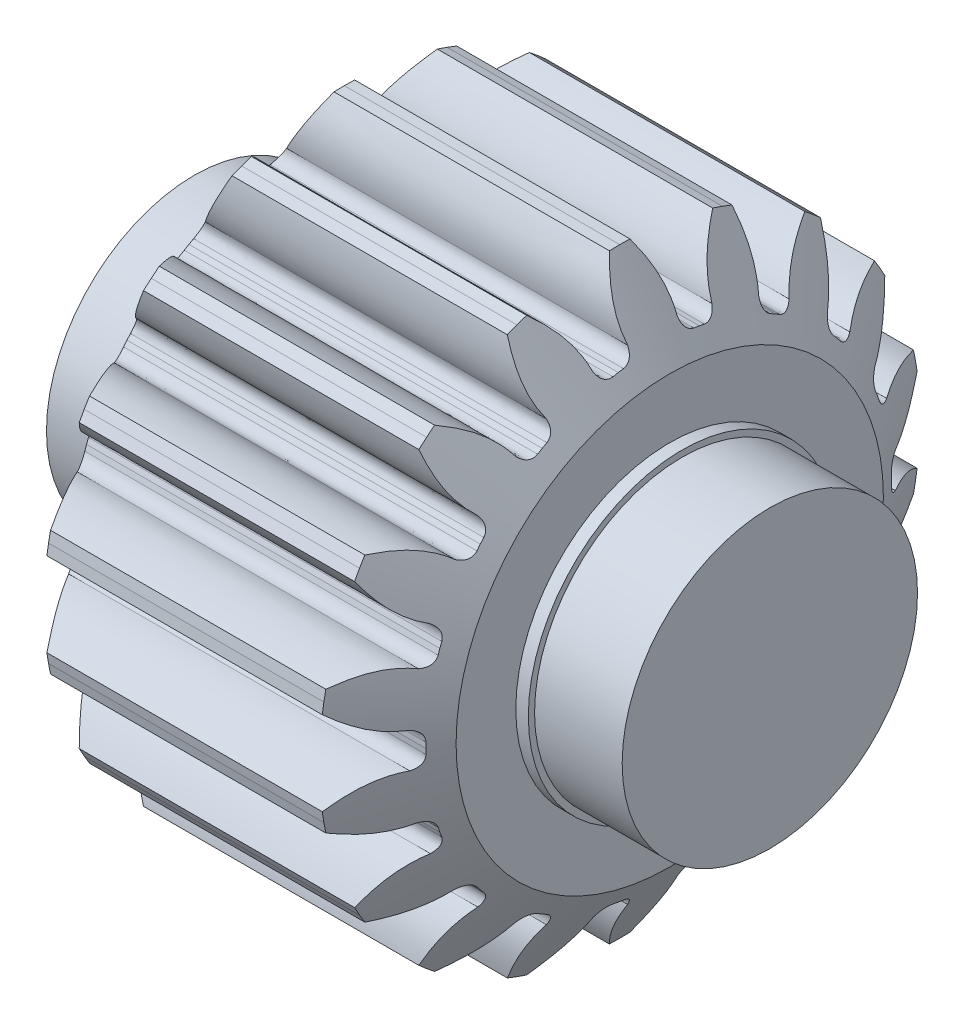
from build123d import *

# Parameters (mm, degrees)
SKETCH4_R          = 13.977653577
CUT_EXTRUDE1_DEPTH = 55.965978094


with BuildPart() as part:
    # Sketch3 → Revolve1 (revolve)
    with BuildSketch(Plane.XY, mode=Mode.PRIVATE) as revolve1_sk:
        Polygon((98.499999011, 42.358835602), (98.499999011, 36.458835602), (121.499999011, 36.458835602), (121.499999011, 42.358835602), (117.999999011, 42.358835602), (117.999999011, 42.608835602), (117.499999011, 42.608835602), (117.499999011, 44.994733987), (115.499999011, 48.458835602), (104.499999011, 48.458835602), (102.499999011, 44.994733987), (102.499999011, 42.608835602), (101.999999011, 42.608835602), (101.999999011, 42.358835602), align=None)
    revolve(revolve1_sk.sketch.rotate(Axis((78.437875692, 36.458835602, 0), (1, 0, 0)), 90), axis=Axis((78.437875692, 36.458835602, 0), (1, 0, 0)))

    # Sketch4 → Cut-Extrude1 (cut, through all)
    with BuildSketch(Plane(origin=(121.499999011, 0, 0), x_dir=(0, 0, -1), z_dir=(1, 0, 0))):
        with Locations((0, 36.458835602)):
            Circle(SKETCH4_R)
        with BuildLine():
            Line((0, 48.458835602), (0.411903779, 48.451764155))
            add(Edge.make_bspline(
                [(0.411903779, 48.451764155), (0.834063086, 47.721667245), (1.119349528, 46.985052709), (0.994321411, 46.133072814)],
                knots=[0, 0, 0, 0, 1, 1, 1, 1], degree=3))
            add(Edge.make_bspline(
                [(0.994321411, 46.133072814), (1.028481403, 45.730941927), (1.404187744, 45.652187347)],
                knots=[0, 0, 0, 1, 1, 1], degree=2))
            Line((1.404187744, 45.652187347), (1.615574453, 45.621213624))
            Line((1.615574453, 45.621213624), (1.82480662, 45.578020891))
            add(Edge.make_bspline(
                [(2.374427505, 45.889722874), (2.204790749, 45.523526851), (1.82480662, 45.578020891)],
                knots=[0, 0, 0, 1, 1, 1], degree=2))
            add(Edge.make_bspline(
                [(3.714760201, 47.869381454), (3.068352366, 47.327701762), (2.548333792, 46.733084228), (2.374427505, 45.889722874)],
                knots=[0, 0, 0, 0, 1, 1, 1, 1], degree=3))
            Line((3.714760201, 47.869381454), (4.10424172, 47.735147051))
            Line((4.10424172, 47.735147051), (4.488886084, 47.587622675))
            add(Edge.make_bspline(
                [(4.488886084, 47.587622675), (4.63587822, 46.75716901), (4.652022775, 45.967404056), (4.243140491, 45.209566971)],
                knots=[0, 0, 0, 0, 1, 1, 1, 1], degree=3))
            add(Edge.make_bspline(
                [(4.243140491, 45.209566971), (4.137703519, 44.820004138), (4.463816343, 44.617499904)],
                knots=[0, 0, 0, 1, 1, 1], degree=2))
            Line((4.463816343, 44.617499904), (4.651861236, 44.516095612))
            Line((4.651861236, 44.516095612), (4.833702375, 44.403946104))
            add(Edge.make_bspline(
                [(5.456785422, 44.508868743), (5.172132598, 44.222776231), (4.833702375, 44.403946104)],
                knots=[0, 0, 0, 1, 1, 1], degree=2))
            add(Edge.make_bspline(
                [(7.393369277, 45.910718522), (6.600679238, 45.622790613), (5.908650448, 45.241889731), (5.456785422, 44.508868743)],
                knots=[0, 0, 0, 0, 1, 1, 1, 1], degree=3))
            Line((7.393369277, 45.910718522), (7.713451316, 45.651368919))
            Line((7.713451316, 45.651368919), (8.024442478, 45.381185231))
            add(Edge.make_bspline(
                [(8.024442478, 45.381185231), (7.878538022, 44.550539779), (7.623593419, 43.802881716), (6.980174205, 43.230593777)],
                knots=[0, 0, 0, 0, 1, 1, 1, 1], degree=3))
            add(Edge.make_bspline(
                [(6.980174205, 43.230593777), (6.747857525, 42.900586026), (6.985042812, 42.598757137)],
                knots=[0, 0, 0, 1, 1, 1], degree=2))
            Line((6.985042812, 42.598757137), (7.1270649, 42.439153131))
            Line((7.1270649, 42.439153131), (7.259582286, 42.271573733))
            add(Edge.make_bspline(
                [(7.880974483, 42.15706181), (7.515638923, 41.985579787), (7.259582286, 42.271573733)],
                knots=[0, 0, 0, 1, 1, 1], degree=2))
            add(Edge.make_bspline(
                [(10.180228903, 42.812019014), (9.336866779, 42.812571244), (8.556296656, 42.691329282), (7.880974483, 42.15706181)],
                knots=[0, 0, 0, 0, 1, 1, 1, 1], degree=3))
            Line((10.180228903, 42.812019014), (10.392304845, 42.458835602))
            Line((10.392304845, 42.458835602), (10.592132682, 42.098580742))
            add(Edge.make_bspline(
                [(10.592132682, 42.098580742), (10.170929864, 41.367931603), (9.675646184, 40.752559029), (8.875295894, 40.434846606)],
                knots=[0, 0, 0, 0, 1, 1, 1, 1], degree=3))
            add(Edge.make_bspline(
                [(8.875295894, 40.434846606), (8.544120326, 40.204197742), (8.66377003, 39.839449217)],
                knots=[0, 0, 0, 1, 1, 1], degree=2))
            Line((8.66377003, 39.839449217), (8.742639352, 39.640896095))
            Line((8.742639352, 39.640896095), (8.809849432, 39.438099356))
            add(Edge.make_bspline(
                [(9.35460171, 39.117964699), (8.952648274, 39.081776428), (8.809849432, 39.438099356)],
                knots=[0, 0, 0, 1, 1, 1], degree=2))
            add(Edge.make_bspline(
                [(11.73920268, 38.947031825), (10.946890388, 39.235997585), (10.171927211, 39.389038113), (9.35460171, 39.117964699)],
                knots=[0, 0, 0, 0, 1, 1, 1, 1], degree=3))
            Line((11.73920268, 38.947031825), (11.817693036, 38.542613734))
            Line((11.817693036, 38.542613734), (11.882255361, 38.135739755))
            add(Edge.make_bspline(
                [(11.882255361, 38.135739755), (11.236557458, 37.593213999), (10.560673222, 37.184349927), (9.699925912, 37.159533829)],
                knots=[0, 0, 0, 0, 1, 1, 1, 1], degree=3))
            add(Edge.make_bspline(
                [(9.699925912, 37.159533829), (9.309836117, 37.056063509), (9.297518718, 36.672389402)],
                knots=[0, 0, 0, 1, 1, 1], degree=2))
            Line((9.297518718, 36.672389402), (9.303722472, 36.458835602))
            Line((9.303722472, 36.458835602), (9.297518718, 36.245281802))
            add(Edge.make_bspline(
                [(9.699925912, 35.758137374), (9.309836117, 35.861607695), (9.297518718, 36.245281802)],
                knots=[0, 0, 0, 1, 1, 1], degree=2))
            add(Edge.make_bspline(
                [(11.882255361, 34.781931448), (11.236557458, 35.324457205), (10.560673222, 35.733321277), (9.699925912, 35.758137374)],
                knots=[0, 0, 0, 0, 1, 1, 1, 1], degree=3))
            Line((11.882255361, 34.781931448), (11.817693036, 34.37505747))
            Line((11.817693036, 34.37505747), (11.73920268, 33.970639379))
            add(Edge.make_bspline(
                [(11.73920268, 33.970639379), (10.946890388, 33.681673618), (10.171927211, 33.52863309), (9.35460171, 33.799706505)],
                knots=[0, 0, 0, 0, 1, 1, 1, 1], degree=3))
            add(Edge.make_bspline(
                [(9.35460171, 33.799706505), (8.952648274, 33.835894776), (8.809849432, 33.479571847)],
                knots=[0, 0, 0, 1, 1, 1], degree=2))
            Line((8.809849432, 33.479571847), (8.742639352, 33.276775109))
            Line((8.742639352, 33.276775109), (8.66377003, 33.078221987))
            add(Edge.make_bspline(
                [(8.875295894, 32.482824597), (8.544120326, 32.713473461), (8.66377003, 33.078221987)],
                knots=[0, 0, 0, 1, 1, 1], degree=2))
            add(Edge.make_bspline(
                [(10.592132682, 30.819090461), (10.170929864, 31.549739601), (9.675646184, 32.165112175), (8.875295894, 32.482824597)],
                knots=[0, 0, 0, 0, 1, 1, 1, 1], degree=3))
            Line((10.592132682, 30.819090461), (10.392304845, 30.458835602))
            Line((10.392304845, 30.458835602), (10.180228903, 30.105652189))
            add(Edge.make_bspline(
                [(10.180228903, 30.105652189), (9.336866779, 30.10509996), (8.556296656, 30.226341922), (7.880974483, 30.760609394)],
                knots=[0, 0, 0, 0, 1, 1, 1, 1], degree=3))
            add(Edge.make_bspline(
                [(7.880974483, 30.760609394), (7.515638923, 30.932091417), (7.259582286, 30.646097471)],
                knots=[0, 0, 0, 1, 1, 1], degree=2))
            Line((7.259582286, 30.646097471), (7.1270649, 30.478518073))
            Line((7.1270649, 30.478518073), (6.985042812, 30.318914067))
            add(Edge.make_bspline(
                [(6.980174205, 29.687077427), (6.747857525, 30.017085178), (6.985042812, 30.318914067)],
                knots=[0, 0, 0, 1, 1, 1], degree=2))
            add(Edge.make_bspline(
                [(8.024442478, 27.536485972), (7.878538022, 28.367131425), (7.623593419, 29.114789487), (6.980174205, 29.687077427)],
                knots=[0, 0, 0, 0, 1, 1, 1, 1], degree=3))
            Line((8.024442478, 27.536485972), (7.713451316, 27.266302284))
            Line((7.713451316, 27.266302284), (7.393369277, 27.006952682))
            add(Edge.make_bspline(
                [(7.393369277, 27.006952682), (6.600679238, 27.294880591), (5.908650448, 27.675781473), (5.456785422, 28.408802461)],
                knots=[0, 0, 0, 0, 1, 1, 1, 1], degree=3))
            add(Edge.make_bspline(
                [(5.456785422, 28.408802461), (5.172132598, 28.694894973), (4.833702375, 28.5137251)],
                knots=[0, 0, 0, 1, 1, 1], degree=2))
            Line((4.833702375, 28.5137251), (4.651861236, 28.401575592))
            Line((4.651861236, 28.401575592), (4.463816343, 28.3001713))
            add(Edge.make_bspline(
                [(4.243140491, 27.708104233), (4.137703519, 28.097667066), (4.463816343, 28.3001713)],
                knots=[0, 0, 0, 1, 1, 1], degree=2))
            add(Edge.make_bspline(
                [(4.488886084, 25.330048528), (4.63587822, 26.160502194), (4.652022775, 26.950267148), (4.243140491, 27.708104233)],
                knots=[0, 0, 0, 0, 1, 1, 1, 1], degree=3))
            Line((4.488886084, 25.330048528), (4.10424172, 25.182524152))
            Line((4.10424172, 25.182524152), (3.714760201, 25.04828975))
            add(Edge.make_bspline(
                [(3.714760201, 25.04828975), (3.068352366, 25.589969441), (2.548333792, 26.184586976), (2.374427505, 27.02794833)],
                knots=[0, 0, 0, 0, 1, 1, 1, 1], degree=3))
            add(Edge.make_bspline(
                [(2.374427505, 27.02794833), (2.204790749, 27.394144352), (1.82480662, 27.339650313)],
                knots=[0, 0, 0, 1, 1, 1], degree=2))
            Line((1.82480662, 27.339650313), (1.615574453, 27.29645758))
            Line((1.615574453, 27.29645758), (1.404187744, 27.265483856))
            add(Edge.make_bspline(
                [(0.994321411, 26.784598389), (1.028481403, 27.186729277), (1.404187744, 27.265483856)],
                knots=[0, 0, 0, 1, 1, 1], degree=2))
            add(Edge.make_bspline(
                [(0.411903779, 24.465907049), (0.834063086, 25.196003959), (1.119349528, 25.932618495), (0.994321411, 26.784598389)],
                knots=[0, 0, 0, 0, 1, 1, 1, 1], degree=3))
            Line((0.411903779, 24.465907049), (0, 24.458835602))
            Line((0, 24.458835602), (-0.411903779, 24.465907049))
            add(Edge.make_bspline(
                [(-0.411903779, 24.465907049), (-0.834063086, 25.196003959), (-1.119349528, 25.932618495), (-0.994321411, 26.784598389)],
                knots=[0, 0, 0, 0, 1, 1, 1, 1], degree=3))
            add(Edge.make_bspline(
                [(-0.994321411, 26.784598389), (-1.028481403, 27.186729277), (-1.404187744, 27.265483856)],
                knots=[0, 0, 0, 1, 1, 1], degree=2))
            Line((-1.404187744, 27.265483856), (-1.615574453, 27.29645758))
            Line((-1.615574453, 27.29645758), (-1.82480662, 27.339650313))
            add(Edge.make_bspline(
                [(-2.374427505, 27.02794833), (-2.204790749, 27.394144352), (-1.82480662, 27.339650313)],
                knots=[0, 0, 0, 1, 1, 1], degree=2))
            add(Edge.make_bspline(
                [(-3.714760201, 25.04828975), (-3.068352366, 25.589969441), (-2.548333792, 26.184586976), (-2.374427505, 27.02794833)],
                knots=[0, 0, 0, 0, 1, 1, 1, 1], degree=3))
            Line((-3.714760201, 25.04828975), (-4.10424172, 25.182524152))
            Line((-4.10424172, 25.182524152), (-4.488886084, 25.330048528))
            add(Edge.make_bspline(
                [(-4.488886084, 25.330048528), (-4.63587822, 26.160502194), (-4.652022775, 26.950267148), (-4.243140491, 27.708104233)],
                knots=[0, 0, 0, 0, 1, 1, 1, 1], degree=3))
            add(Edge.make_bspline(
                [(-4.243140491, 27.708104233), (-4.137703519, 28.097667066), (-4.463816343, 28.3001713)],
                knots=[0, 0, 0, 1, 1, 1], degree=2))
            Line((-4.463816343, 28.3001713), (-4.651861236, 28.401575592))
            Line((-4.651861236, 28.401575592), (-4.833702375, 28.5137251))
            add(Edge.make_bspline(
                [(-5.456785422, 28.408802461), (-5.172132598, 28.694894973), (-4.833702375, 28.5137251)],
                knots=[0, 0, 0, 1, 1, 1], degree=2))
            add(Edge.make_bspline(
                [(-7.393369277, 27.006952682), (-6.600679238, 27.294880591), (-5.908650448, 27.675781473), (-5.456785422, 28.408802461)],
                knots=[0, 0, 0, 0, 1, 1, 1, 1], degree=3))
            Line((-7.393369277, 27.006952682), (-7.713451316, 27.266302284))
            Line((-7.713451316, 27.266302284), (-8.024442478, 27.536485972))
            add(Edge.make_bspline(
                [(-8.024442478, 27.536485972), (-7.878538022, 28.367131425), (-7.623593419, 29.114789487), (-6.980174205, 29.687077427)],
                knots=[0, 0, 0, 0, 1, 1, 1, 1], degree=3))
            add(Edge.make_bspline(
                [(-6.980174205, 29.687077427), (-6.747857525, 30.017085178), (-6.985042812, 30.318914067)],
                knots=[0, 0, 0, 1, 1, 1], degree=2))
            Line((-6.985042812, 30.318914067), (-7.1270649, 30.478518073))
            Line((-7.1270649, 30.478518073), (-7.259582286, 30.646097471))
            add(Edge.make_bspline(
                [(-7.880974483, 30.760609394), (-7.515638923, 30.932091417), (-7.259582286, 30.646097471)],
                knots=[0, 0, 0, 1, 1, 1], degree=2))
            add(Edge.make_bspline(
                [(-10.180228903, 30.105652189), (-9.336866779, 30.10509996), (-8.556296656, 30.226341922), (-7.880974483, 30.760609394)],
                knots=[0, 0, 0, 0, 1, 1, 1, 1], degree=3))
            Line((-10.180228903, 30.105652189), (-10.392304845, 30.458835602))
            Line((-10.392304845, 30.458835602), (-10.592132682, 30.819090461))
            add(Edge.make_bspline(
                [(-10.592132682, 30.819090461), (-10.170929864, 31.549739601), (-9.675646184, 32.165112175), (-8.875295894, 32.482824597)],
                knots=[0, 0, 0, 0, 1, 1, 1, 1], degree=3))
            add(Edge.make_bspline(
                [(-8.875295894, 32.482824597), (-8.544120326, 32.713473461), (-8.66377003, 33.078221987)],
                knots=[0, 0, 0, 1, 1, 1], degree=2))
            Line((-8.66377003, 33.078221987), (-8.742639352, 33.276775109))
            Line((-8.742639352, 33.276775109), (-8.809849432, 33.479571847))
            add(Edge.make_bspline(
                [(-9.35460171, 33.799706505), (-8.952648274, 33.835894776), (-8.809849432, 33.479571847)],
                knots=[0, 0, 0, 1, 1, 1], degree=2))
            add(Edge.make_bspline(
                [(-11.73920268, 33.970639379), (-10.946890388, 33.681673618), (-10.171927211, 33.52863309), (-9.35460171, 33.799706505)],
                knots=[0, 0, 0, 0, 1, 1, 1, 1], degree=3))
            Line((-11.73920268, 33.970639379), (-11.817693036, 34.37505747))
            Line((-11.817693036, 34.37505747), (-11.882255361, 34.781931448))
            add(Edge.make_bspline(
                [(-11.882255361, 34.781931448), (-11.236557458, 35.324457205), (-10.560673222, 35.733321277), (-9.699925912, 35.758137374)],
                knots=[0, 0, 0, 0, 1, 1, 1, 1], degree=3))
            add(Edge.make_bspline(
                [(-9.699925912, 35.758137374), (-9.309836117, 35.861607695), (-9.297518718, 36.245281802)],
                knots=[0, 0, 0, 1, 1, 1], degree=2))
            Line((-9.297518718, 36.245281802), (-9.303722472, 36.458835602))
            Line((-9.303722472, 36.458835602), (-9.297518718, 36.672389402))
            add(Edge.make_bspline(
                [(-9.699925912, 37.159533829), (-9.309836117, 37.056063509), (-9.297518718, 36.672389402)],
                knots=[0, 0, 0, 1, 1, 1], degree=2))
            add(Edge.make_bspline(
                [(-11.882255361, 38.135739755), (-11.236557458, 37.593213999), (-10.560673222, 37.184349927), (-9.699925912, 37.159533829)],
                knots=[0, 0, 0, 0, 1, 1, 1, 1], degree=3))
            Line((-11.882255361, 38.135739755), (-11.817693036, 38.542613734))
            Line((-11.817693036, 38.542613734), (-11.73920268, 38.947031825))
            add(Edge.make_bspline(
                [(-11.73920268, 38.947031825), (-10.946890388, 39.235997585), (-10.171927211, 39.389038113), (-9.35460171, 39.117964699)],
                knots=[0, 0, 0, 0, 1, 1, 1, 1], degree=3))
            add(Edge.make_bspline(
                [(-9.35460171, 39.117964699), (-8.952648274, 39.081776428), (-8.809849432, 39.438099356)],
                knots=[0, 0, 0, 1, 1, 1], degree=2))
            Line((-8.809849432, 39.438099356), (-8.742639352, 39.640896095))
            Line((-8.742639352, 39.640896095), (-8.66377003, 39.839449217))
            add(Edge.make_bspline(
                [(-8.875295894, 40.434846606), (-8.544120326, 40.204197742), (-8.66377003, 39.839449217)],
                knots=[0, 0, 0, 1, 1, 1], degree=2))
            add(Edge.make_bspline(
                [(-10.592132682, 42.098580742), (-10.170929864, 41.367931603), (-9.675646184, 40.752559029), (-8.875295894, 40.434846606)],
                knots=[0, 0, 0, 0, 1, 1, 1, 1], degree=3))
            Line((-10.592132682, 42.098580742), (-10.392304845, 42.458835602))
            Line((-10.392304845, 42.458835602), (-10.180228903, 42.812019014))
            add(Edge.make_bspline(
                [(-10.180228903, 42.812019014), (-9.336866779, 42.812571244), (-8.556296656, 42.691329282), (-7.880974483, 42.15706181)],
                knots=[0, 0, 0, 0, 1, 1, 1, 1], degree=3))
            add(Edge.make_bspline(
                [(-7.880974483, 42.15706181), (-7.515638923, 41.985579787), (-7.259582286, 42.271573733)],
                knots=[0, 0, 0, 1, 1, 1], degree=2))
            Line((-7.259582286, 42.271573733), (-7.1270649, 42.439153131))
            Line((-7.1270649, 42.439153131), (-6.985042812, 42.598757137))
            add(Edge.make_bspline(
                [(-6.980174205, 43.230593777), (-6.747857525, 42.900586026), (-6.985042812, 42.598757137)],
                knots=[0, 0, 0, 1, 1, 1], degree=2))
            add(Edge.make_bspline(
                [(-8.024442478, 45.381185231), (-7.878538022, 44.550539779), (-7.623593419, 43.802881716), (-6.980174205, 43.230593777)],
                knots=[0, 0, 0, 0, 1, 1, 1, 1], degree=3))
            Line((-8.024442478, 45.381185231), (-7.713451316, 45.651368919))
            Line((-7.713451316, 45.651368919), (-7.393369277, 45.910718522))
            add(Edge.make_bspline(
                [(-7.393369277, 45.910718522), (-6.600679238, 45.622790613), (-5.908650448, 45.241889731), (-5.456785422, 44.508868743)],
                knots=[0, 0, 0, 0, 1, 1, 1, 1], degree=3))
            add(Edge.make_bspline(
                [(-5.456785422, 44.508868743), (-5.172132598, 44.222776231), (-4.833702375, 44.403946104)],
                knots=[0, 0, 0, 1, 1, 1], degree=2))
            Line((-4.833702375, 44.403946104), (-4.651861236, 44.516095612))
            Line((-4.651861236, 44.516095612), (-4.463816343, 44.617499904))
            add(Edge.make_bspline(
                [(-4.243140491, 45.209566971), (-4.137703519, 44.820004138), (-4.463816343, 44.617499904)],
                knots=[0, 0, 0, 1, 1, 1], degree=2))
            add(Edge.make_bspline(
                [(-4.488886084, 47.587622675), (-4.63587822, 46.75716901), (-4.652022775, 45.967404056), (-4.243140491, 45.209566971)],
                knots=[0, 0, 0, 0, 1, 1, 1, 1], degree=3))
            Line((-4.488886084, 47.587622675), (-4.10424172, 47.735147051))
            Line((-4.10424172, 47.735147051), (-3.714760201, 47.869381454))
            add(Edge.make_bspline(
                [(-3.714760201, 47.869381454), (-3.068352366, 47.327701762), (-2.548333792, 46.733084228), (-2.374427505, 45.889722874)],
                knots=[0, 0, 0, 0, 1, 1, 1, 1], degree=3))
            add(Edge.make_bspline(
                [(-2.374427505, 45.889722874), (-2.204790749, 45.523526851), (-1.82480662, 45.578020891)],
                knots=[0, 0, 0, 1, 1, 1], degree=2))
            Line((-1.82480662, 45.578020891), (-1.615574453, 45.621213624))
            Line((-1.615574453, 45.621213624), (-1.404187744, 45.652187347))
            add(Edge.make_bspline(
                [(-0.994321411, 46.133072814), (-1.028481403, 45.730941927), (-1.404187744, 45.652187347)],
                knots=[0, 0, 0, 1, 1, 1], degree=2))
            add(Edge.make_bspline(
                [(-0.411903779, 48.451764155), (-0.834063086, 47.721667245), (-1.119349528, 46.985052709), (-0.994321411, 46.133072814)],
                knots=[0, 0, 0, 0, 1, 1, 1, 1], degree=3))
            Line((-0.411903779, 48.451764155), (0, 48.458835602))
        make_face(mode=Mode.SUBTRACT)
    extrude(amount=-CUT_EXTRUDE1_DEPTH, mode=Mode.SUBTRACT)


solid = part.part
